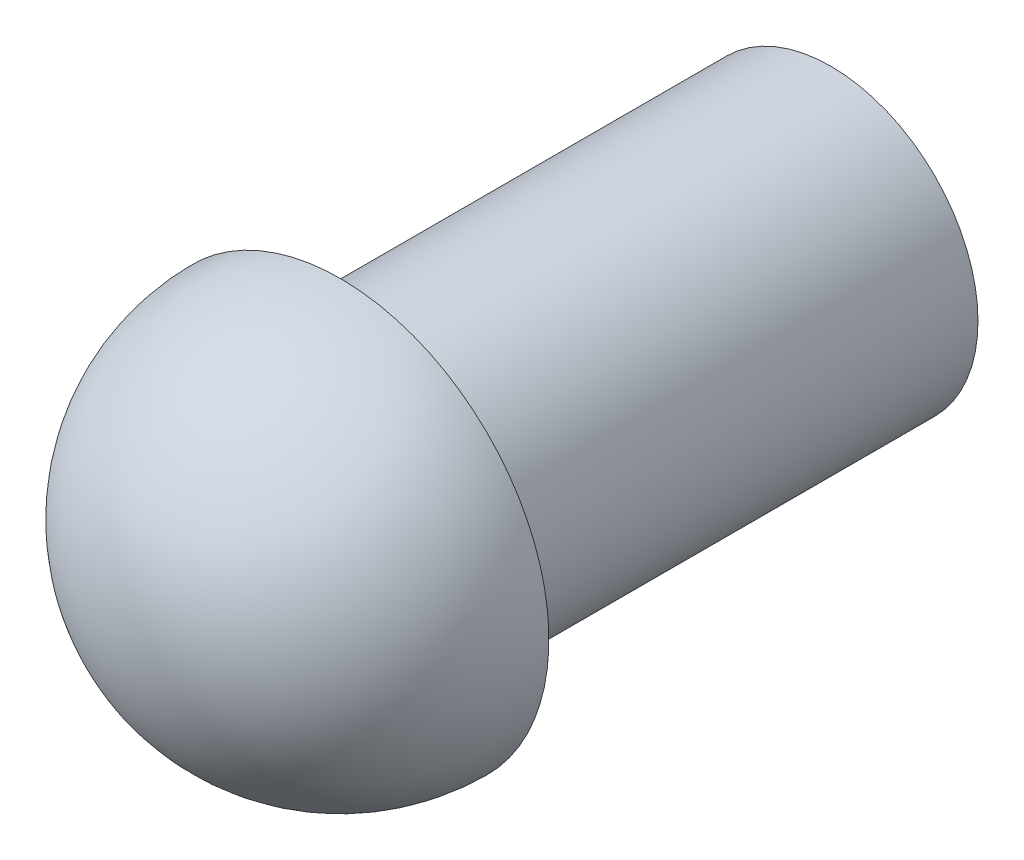
from build123d import *

# Parameters (mm, degrees)
ESQUISSE1_R        = 3
BOSS_EXTRU_1_DEPTH = 10
R_VOLUTION1_ANGLE  = 180


with BuildPart() as part:
    # Esquisse1 → Boss.-Extru.1 (new body)
    with BuildSketch(Plane.XY):
        Circle(ESQUISSE1_R)
    extrude(amount=BOSS_EXTRU_1_DEPTH)

    # Esquisse3 → Révolution1 (revolve)
    with BuildSketch(Plane.XY.offset(10)):
        with BuildLine():
            Line((0, -4.25), (0, 4.25))
            ThreePointArc((0, 4.25), (-4.25, 0), (0, -4.25))
        make_face()
    revolve(axis=Axis((0, -4.25, 10), (0, 1, 0)), revolution_arc=R_VOLUTION1_ANGLE)


solid = part.part
